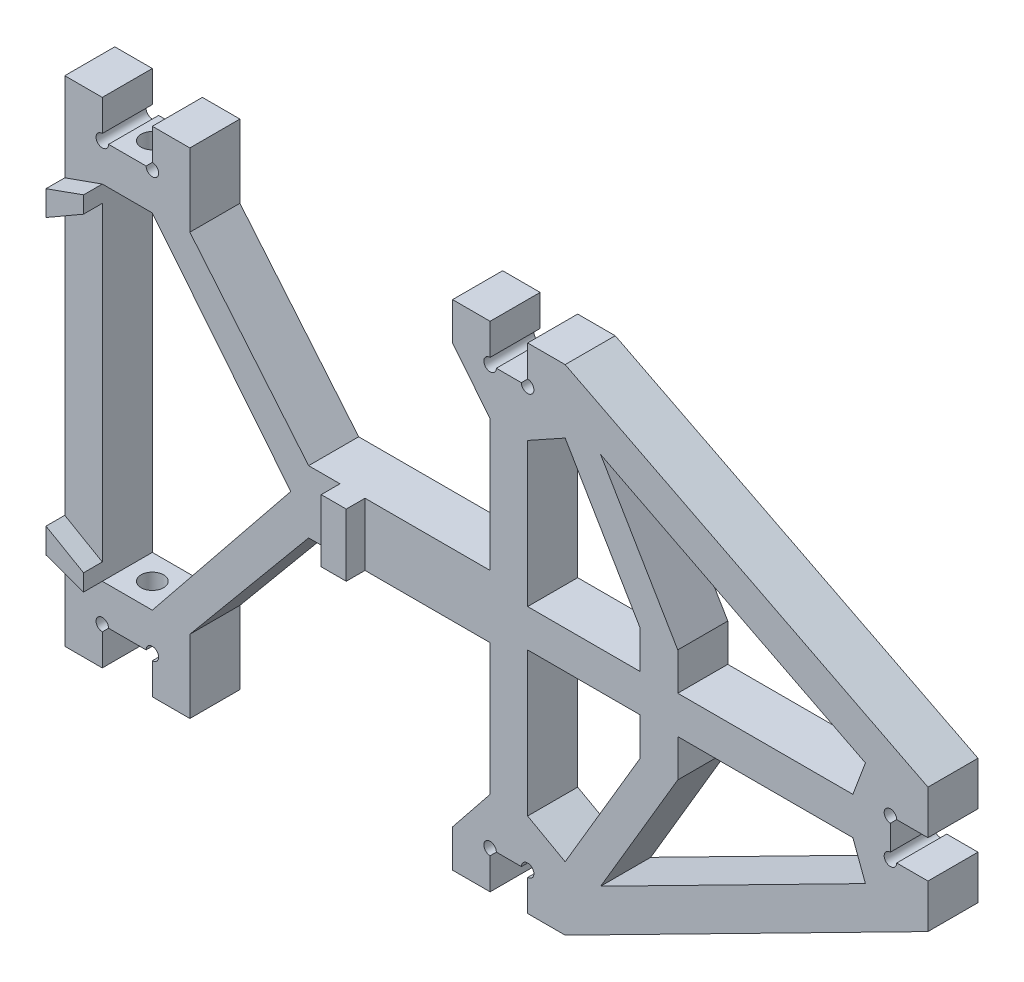
from build123d import *

# Parameters (mm, degrees)
EXTRUDE_1_DEPTH     = 4
SKETCH_2_R          = 0.9
CUT_EXTRUDE_1_DEPTH = 52
SKETCH_3_W          = 2.000000328
SKETCH_3_H          = 4.999999888
EXTRUDE_2_DEPTH     = 1.5


with BuildPart() as part:
    # 草图1 → 凸台-拉伸1 (new body)
    with BuildSketch(Plane.XY):
        with BuildLine():
            Line((66.000003368, -0.999999465), (66.000003368, 1.000000862))
            ThreePointArc((66.000003368, 1.000000862), (65.646447605, 1.853552596), (66.500000656, 1.500000013))
            Line((66.500000656, 1.500000013), (69.000001997, 1.500000013))
            Line((69.000001997, 1.500000013), (69.000001997, 4.999999655))
            Line((69.000001997, 4.999999655), (40.0000019, 19.749999745))
            Line((40.0000019, 19.749999745), (37.000001874, 19.749999745))
            Line((37.000001874, 19.749999745), (37.000001874, 17.250002129))
            ThreePointArc((37.000001874, 17.250002129), (37.353555819, 16.396448761), (36.500001792, 16.750001116))
            Line((36.500001792, 16.750001116), (34.500001871, 16.750001116))
            ThreePointArc((34.500001871, 16.750001116), (33.646447808, 16.396448765), (34.000001848, 17.250002129))
            Line((34.000001848, 17.250002129), (34.000001848, 19.749999745))
            Line((34.000001848, 19.749999745), (31.000001822, 19.749999745))
            Line((31.000001822, 19.749999745), (31.000001822, 16.750001116))
            Line((31.000001822, 16.750001116), (34.000001848, 13.000000967))
            Line((34.000001848, 13.000000967), (34.000001848, 2.500000177))
            Line((34.000001848, 2.500000177), (19.492642954, 2.500000177))
            Line((19.492642954, 2.500000177), (10.000001639, 13.915917603))
            Line((10.000001639, 13.915917603), (10.000001639, 19.749999745))
            Line((10.000001639, 19.749999745), (7.000001147, 19.749999745))
            Line((7.000001147, 19.749999745), (7.000001147, 17.250002129))
            ThreePointArc((7.000001147, 17.250002129), (7.353556004, 16.396449439), (6.500001997, 16.750001116))
            Line((6.500001997, 16.750001116), (3.500001505, 16.750001116))
            ThreePointArc((3.500001505, 16.750001116), (2.646447808, 16.396449749), (3.000002354, 17.250002129))
            Line((3.000002354, 17.250002129), (3.000002354, 19.749999745))
            Line((3.000002354, 19.749999745), (0, 19.749999745))
            Line((0, 19.749999745), (0, -19.749999745))
            Line((0, -19.749999745), (3.000002354, -19.749999745))
            Line((3.000002354, -19.749999745), (3.000002354, -17.249999742))
            ThreePointArc((3.000002354, -17.249999742), (2.646448465, -16.39644732), (3.500001505, -16.749999719))
            Line((3.500001505, -16.749999719), (6.500001997, -16.749999719))
            ThreePointArc((6.500001997, -16.749999719), (7.353555348, -16.396447009), (7.000001147, -17.249999742))
            Line((7.000001147, -17.249999742), (7.000001147, -19.749999745))
            Line((7.000001147, -19.749999745), (10.000001639, -19.749999745))
            Line((10.000001639, -19.749999745), (10.000001639, -13.915917138))
            Line((10.000001639, -13.915917138), (19.492642954, -2.499999711))
            Line((19.492642954, -2.499999711), (34.000001848, -2.499999711))
            Line((34.000001848, -2.499999711), (34.000001848, -12.999999803))
            Line((34.000001848, -12.999999803), (31.000001822, -16.749999719))
            Line((31.000001822, -16.749999719), (31.000001822, -19.749999745))
            Line((31.000001822, -19.749999745), (34.000001848, -19.749999745))
            Line((34.000001848, -19.749999745), (34.000001848, -17.249999742))
            ThreePointArc((34.000001848, -17.249999742), (33.646448464, -16.396446335), (34.500001871, -16.749999719))
            Line((34.500001871, -16.749999719), (36.500001792, -16.749999719))
            ThreePointArc((36.500001792, -16.749999719), (37.353555162, -16.396446331), (37.000001874, -17.249999742))
            Line((37.000001874, -17.249999742), (37.000001874, -19.749999745))
            Line((37.000001874, -19.749999745), (40.0000019, -19.749999745))
            Line((40.0000019, -19.749999745), (69.000001997, -5.000000121))
            Line((69.000001997, -5.000000121), (69.000001997, -1.499999547))
            Line((69.000001997, -1.499999547), (66.500000656, -1.499999547))
            ThreePointArc((66.500000656, -1.499999547), (65.646447327, -1.853550818), (66.000003368, -0.999999465))
        make_face()
        Polygon((37.000001874, 13.000000967), (37.000001874, 1.500000013), (46.000001952, 1.500000013), (46.000001952, 4.500000505), (40.0000019, 14.666666044), align=None, mode=Mode.SUBTRACT)
        Polygon((42.838321999, -14.940624125), (49.000001512, -4.500000039), (49.000001512, -1.499999547), (63.000001013, -1.499999547), (64.000001177, -4.17735544), align=None, mode=Mode.SUBTRACT)
        Polygon((46.000001952, -1.499999547), (37.000001874, -1.499999547), (37.000001874, -12.999999803), (40.0000019, -14.666666277), (46.000001952, -4.500000039), align=None, mode=Mode.SUBTRACT)
        Polygon((63.000001013, 1.500000013), (64.000001177, 4.177356837), (42.838321999, 14.940623892), (49.000001512, 4.500000505), (49.000001512, 1.500000013), align=None, mode=Mode.SUBTRACT)
        Polygon((3.000002354, -13.749999693), (7.000001147, -13.749999693), (18.065146907, -1.59e-07), (7.000001147, 13.750000624), (3.000002354, 13.750000624), align=None, mode=Mode.SUBTRACT)
    extrude(amount=EXTRUDE_1_DEPTH)

    # 草图2 → 切除-拉伸1 (cut)
    with BuildSketch(Plane.XZ.offset(16.749999719)):
        with Locations((5.000002354, 2)):
            Circle(SKETCH_2_R)
    extrude(amount=-CUT_EXTRUDE_1_DEPTH, mode=Mode.SUBTRACT)

    # 草图3 → 凸台-拉伸2 (add)
    with BuildSketch(Plane.XY.offset(4)):
        Polygon((3.000002354, 12.413031189), (3.000002354, 13.750000624), (0, 12.680980144), (0, 10.680979816), align=None)
        with Locations((23.000001907, 2.33e-07)):
            Rectangle(SKETCH_3_W, SKETCH_3_H)
        Polygon((3.000002354, -13.749999693), (3.000002354, -12.413030723), (0, -10.680979816), (0, -12.680979678), align=None)
    extrude(amount=EXTRUDE_2_DEPTH)


solid = part.part
